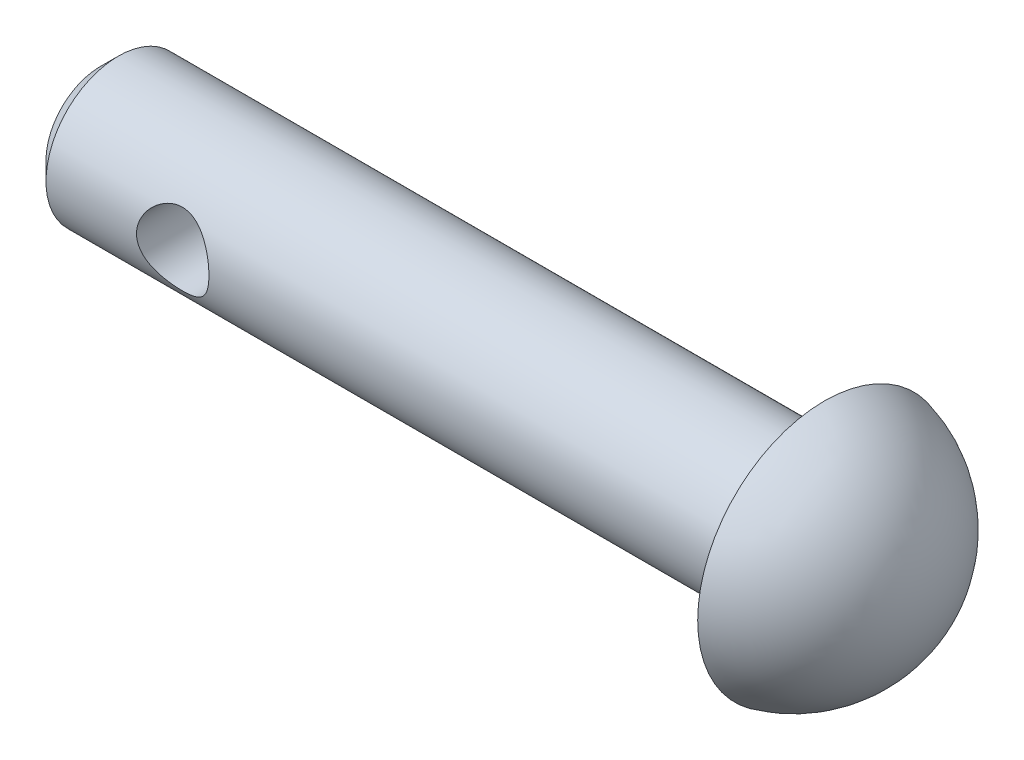
from build123d import *

# Parameters (mm, degrees)
SKETCH1_R               = 2
BOSS_EXTRUDE1_DEPTH     = 20
CUT_EXTRUDE1_DEPTH      = 21.199009877
CUT_EXTRUDE1_DEPTH_BACK = 21.199009877
SKETCH2_R               = 1
CHAMFER1_SIZE           = 0.5


with BuildPart() as part:
    # Sketch1 → Boss-Extrude1 (new body)
    with BuildSketch(Plane(origin=(0, 0, 0), x_dir=(0, 0, -1), z_dir=(1, 0, 0))):
        Circle(SKETCH1_R)
    extrude(amount=-BOSS_EXTRUDE1_DEPTH)

    # Sketch2 → Cut-Extrude1 (cut, two sides: drawn at the far end of the back side and taken through both)
    with BuildSketch(Plane.XY.offset(-CUT_EXTRUDE1_DEPTH_BACK)):
        with Locations((-16, 0)):
            Circle(SKETCH2_R)
    extrude(amount=CUT_EXTRUDE1_DEPTH + CUT_EXTRUDE1_DEPTH_BACK, mode=Mode.SUBTRACT)

    # Chamfer1
    chamfer1_edges = [part.edges().sort_by_distance(p)[0] for p in [
        (-20, 0, 2),
    ]]
    chamfer(chamfer1_edges, length=CHAMFER1_SIZE)

    # Sketch3 → Revolve1 (revolve)
    with BuildSketch(Plane(origin=(0, 0, 0), x_dir=(1, 0, 0), z_dir=(0, 1, 0))):
        with BuildLine():
            Line((0, 3.5), (0, 0))
            Line((0, 0), (2.757385023, 0))
            ThreePointArc((2.757385023, 0), (1.985229955, 2.227844932), (0, 3.5))
        make_face()
    revolve(axis=Axis((-5.090118755, 0, 0), (1, 0, 0)))


solid = part.part
